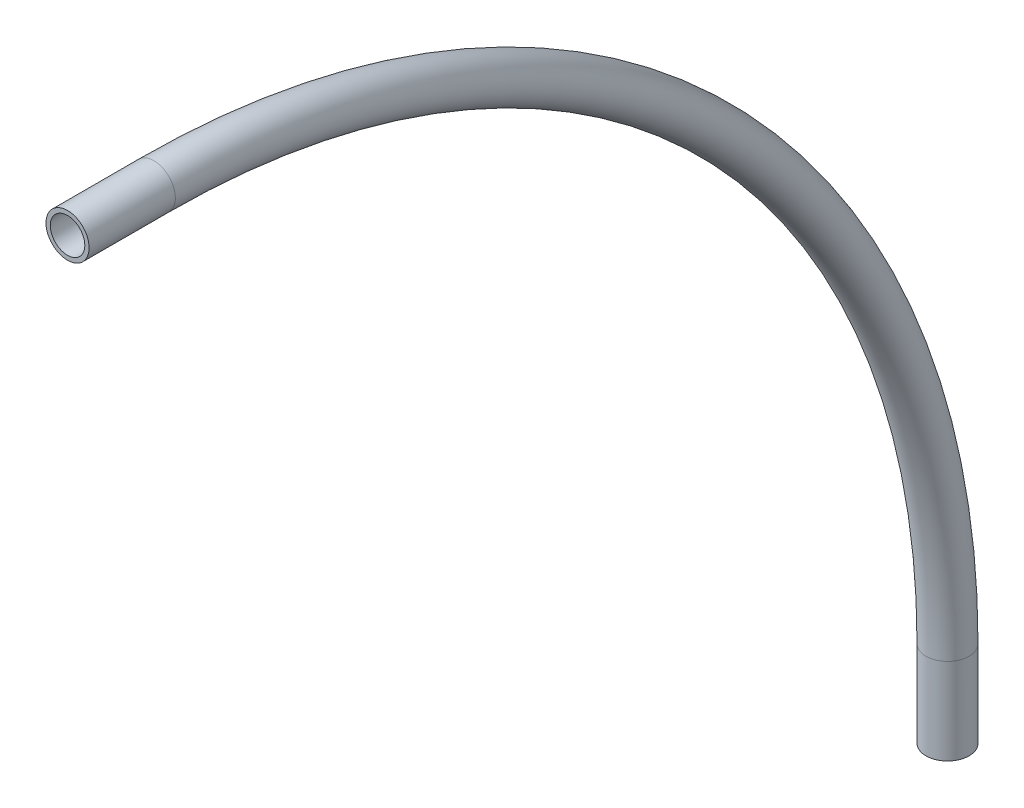
from build123d import *

# Parameters (mm, degrees)
SKETCH1_R   = 3.175
SKETCH1_R_2 = 2.54


with BuildPart() as part:
    # Sweep1: sweep along a path in Sketch2
    with BuildLine(Plane(origin=(0, 0, 0), x_dir=(0, 0, -1), z_dir=(1, 0, 0))) as sweep1_path:
        Line((0, 0), (12.7, 0))
        ThreePointArc((12.7, 0), (95.318356314, -34.221643686), (129.54, -116.84))
        Line((129.54, -116.84), (129.54, -129.54))
    # Sketch1 → Sweep1 (sweep)
    with BuildSketch(Plane.XY):
        Circle(SKETCH1_R)
        Circle(SKETCH1_R_2, mode=Mode.SUBTRACT)
    sweep(path=sweep1_path.line)


solid = part.part
